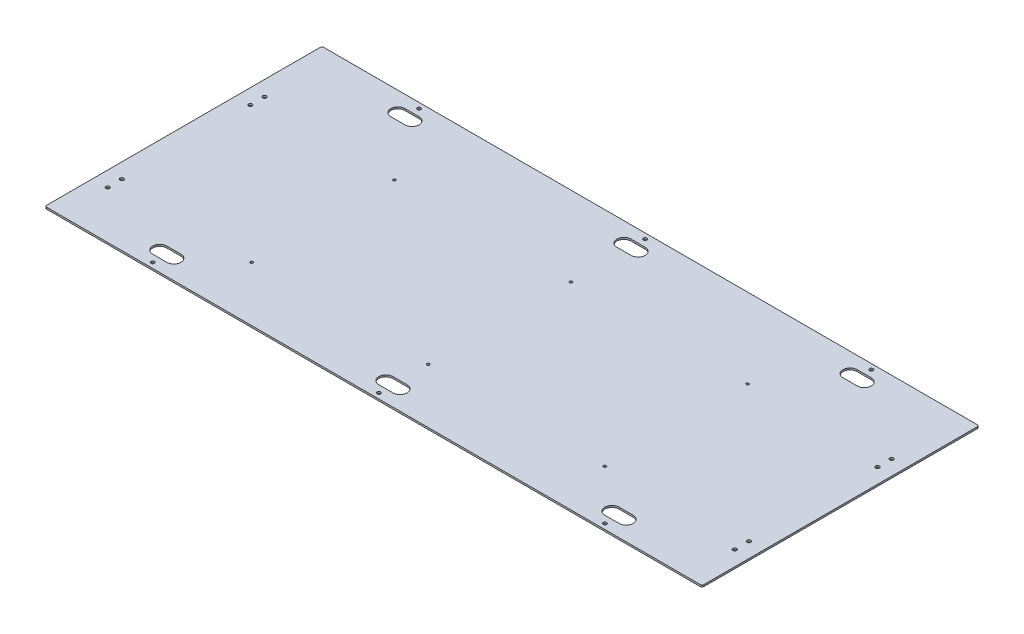
from build123d import *

# Parameters (mm, degrees)
BOSS_EXTRUDE1_DEPTH              = 3.175
F_1_4_0_25_DIAMETER_HOLE1_D      = 6.35
CUT_EXTRUDE1_DEPTH               = 641.874831402
F_10_0_1935_DIAMETER_HOLE7_D     = 4.9149
F_17_64_0_26563_DIAMETER_HOLE1_D = 6.747002


with BuildPart() as part:
    # Sketch1 → Boss-Extrude1 (new body)
    with BuildSketch(Plane(origin=(0, 0, 0), x_dir=(1, 0, 0), z_dir=(0, 1, 0))):
        with BuildLine():
            Line((-587.375, -248.92), (587.375, -248.92))
            ThreePointArc((587.375, -248.92), (589.62006403, -247.99006403), (590.55, -245.745))
            Line((590.55, -245.745), (590.55, 245.745))
            ThreePointArc((590.55, 245.745), (589.62006403, 247.99006403), (587.375, 248.92))
            Line((587.375, 248.92), (-587.375, 248.92))
            ThreePointArc((-587.375, 248.92), (-589.62006403, 247.99006403), (-590.55, 245.745))
            Line((-590.55, 245.745), (-590.55, -245.745))
            ThreePointArc((-590.55, -245.745), (-589.62006403, -247.99006403), (-587.375, -248.92))
        make_face()
    extrude(amount=BOSS_EXTRUDE1_DEPTH)

    # 1/4 (0.25) Diameter Hole1 (through all)
    with Locations(Plane(origin=(0, 3.175, 0), x_dir=(1, 0, 0), z_dir=(0, 1, 0))):
        with Locations((-406.4, 239.395), (0, 239.395), (406.4, 239.395), (406.4, -239.395), (0, -239.395), (-406.4, -239.395)):
            Hole(F_1_4_0_25_DIAMETER_HOLE1_D / 2)

    # Sketch5 → Cut-Extrude1 (cut, through all)
    with BuildSketch(Plane(origin=(0, 3.175, 0), x_dir=(1, 0, 0), z_dir=(0, 1, 0))):
        with BuildLine():
            Line((-419.1, 226.695), (-393.7, 226.695))
            ThreePointArc((-393.7, 226.695), (-381, 213.995), (-393.7, 201.295))
            Line((-393.7, 201.295), (-419.1, 201.295))
            ThreePointArc((-419.1, 201.295), (-431.8, 213.995), (-419.1, 226.695))
        make_face()
        with BuildLine():
            Line((-12.7, 226.695), (12.7, 226.695))
            ThreePointArc((12.7, 226.695), (25.4, 213.995), (12.7, 201.295))
            Line((12.7, 201.295), (-12.7, 201.295))
            ThreePointArc((-12.7, 201.295), (-25.4, 213.995), (-12.7, 226.695))
        make_face()
        with BuildLine():
            Line((393.7, 226.695), (419.1, 226.695))
            ThreePointArc((419.1, 226.695), (431.8, 213.995), (419.1, 201.295))
            Line((419.1, 201.295), (393.7, 201.295))
            ThreePointArc((393.7, 201.295), (381, 213.995), (393.7, 226.695))
        make_face()
        with BuildLine():
            Line((-419.1, -201.295), (-393.7, -201.295))
            ThreePointArc((-393.7, -201.295), (-381, -213.995), (-393.7, -226.695))
            Line((-393.7, -226.695), (-419.1, -226.695))
            ThreePointArc((-419.1, -226.695), (-431.8, -213.995), (-419.1, -201.295))
        make_face()
        with BuildLine():
            Line((-12.7, -201.295), (12.7, -201.295))
            ThreePointArc((12.7, -201.295), (25.4, -213.995), (12.7, -226.695))
            Line((12.7, -226.695), (-12.7, -226.695))
            ThreePointArc((-12.7, -226.695), (-25.4, -213.995), (-12.7, -201.295))
        make_face()
        with BuildLine():
            Line((393.7, -201.295), (419.1, -201.295))
            ThreePointArc((419.1, -201.295), (431.8, -213.995), (419.1, -226.695))
            Line((419.1, -226.695), (393.7, -226.695))
            ThreePointArc((393.7, -226.695), (381, -213.995), (393.7, -201.295))
        make_face()
    extrude(amount=-CUT_EXTRUDE1_DEPTH, mode=Mode.SUBTRACT)

    # #10 (0.1935) Diameter Hole7 (through all)
    with Locations(Plane(origin=(-317.5, 3.175, -106.045), x_dir=(0, 0, 1), z_dir=(0, 1, 0))):
        with Locations((0, 0), (0, 317.5), (0, 635), (256.54, 635), (256.54, 317.5), (256.54, 0)):
            Hole(F_10_0_1935_DIAMETER_HOLE7_D / 2)

    # 17/64 (0.26563) Diameter Hole1 (through all)
    with Locations(Plane(origin=(0, 3.175, 0), x_dir=(1, 0, 0), z_dir=(0, 1, 0))):
        with Locations((-563.5625, 118.745), (-563.5625, 93.345), (-563.5625, -137.795), (-563.5625, -163.195), (563.5625, -163.195), (563.5625, -137.795), (563.5625, 118.745), (563.5625, 93.345)):
            Hole(F_17_64_0_26563_DIAMETER_HOLE1_D / 2)


solid = part.part
